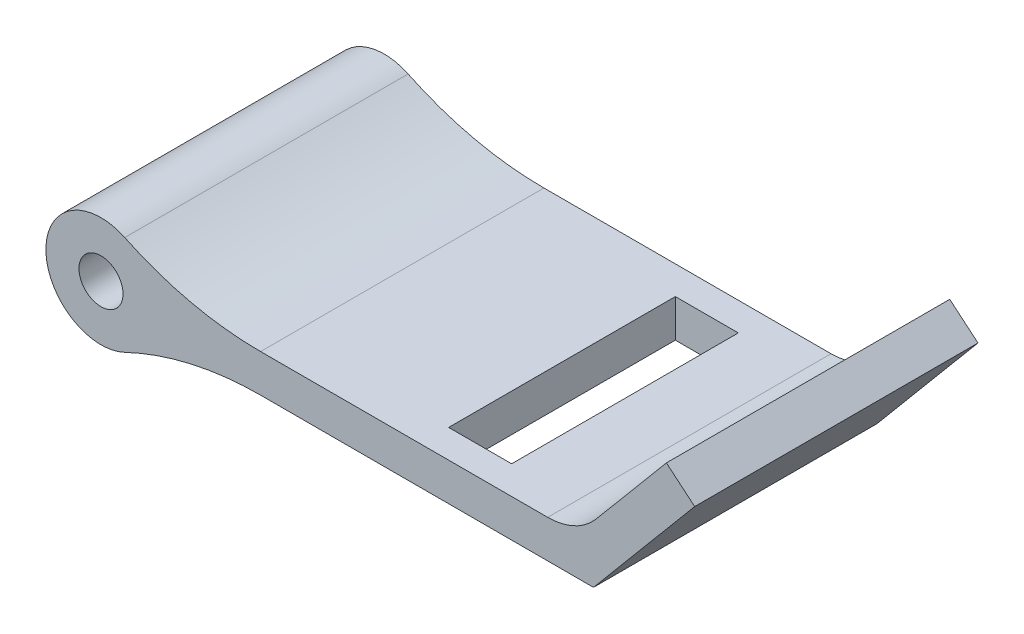
from build123d import *

# Parameters (mm, degrees)
SKETCH1_W                = 14
SKETCH1_H                = 9
SKETCH1_W_2              = 2
SKETCH1_H_2              = 7.2
BOSS_EXTRUDE1_DEPTH      = 1.2
BOSS_EXTRUDE2_DEPTH      = 4.5
BOSS_EXTRUDE2_DEPTH_BACK = 4.5
SKETCH2_R                = 1.75
SKETCH2_R_2              = 0.7
FILLET1_R                = 10
BOSS_EXTRUDE3_DEPTH      = 0.771345
BOSS_EXTRUDE3_DEPTH_BACK = 0.4
SKETCH3_W                = 9
SKETCH3_H                = 5
FILLET2_R                = 2


with BuildPart() as part:
    # Sketch1 → Boss-Extrude1 (new body)
    with BuildSketch(Plane(origin=(0, 0, 0), x_dir=(1, 0, 0), z_dir=(0, 1, 0))):
        Rectangle(SKETCH1_W, SKETCH1_H)
        with Locations((2.5, 0)):
            Rectangle(SKETCH1_W_2, SKETCH1_H_2, mode=Mode.SUBTRACT)
    extrude(amount=BOSS_EXTRUDE1_DEPTH)

    # Sketch2 → Boss-Extrude2 (add, two sides: drawn at the far end of the back side and taken through both)
    with BuildSketch(Plane.XY.offset(-BOSS_EXTRUDE2_DEPTH_BACK)):
        with Locations((-8.643928222, 0.6)):
            Circle(SKETCH2_R)
        with Locations((-8.643928222, 0.6)):
            Circle(SKETCH2_R_2, mode=Mode.SUBTRACT)
    extrude(amount=BOSS_EXTRUDE2_DEPTH + BOSS_EXTRUDE2_DEPTH_BACK)

    # Fillet1
    fillet1_edges = [part.edges().sort_by_distance(p)[0] for p in [
        (-7, 1.2, 0),
        (-7, 0, 0),
    ]]
    fillet(fillet1_edges, radius=FILLET1_R)

    # Sketch3 → Boss-Extrude3 (add, two sides: drawn at the far end of the back side and taken through both)
    with BuildSketch(Plane(origin=(3.51688397, -2.951016042, 0), x_dir=(0, 0, -1), z_dir=(0.7660444431189749, -0.642787609686543, 0)).offset(-BOSS_EXTRUDE3_DEPTH_BACK)):
        with Locations((0, 6.999513268)):
            Rectangle(SKETCH3_W, SKETCH3_H)
    extrude(amount=BOSS_EXTRUDE3_DEPTH + BOSS_EXTRUDE3_DEPTH_BACK)

    # Fillet2
    fillet2_edges = [part.edges().sort_by_distance(p)[0] for p in [
        (6.477837084, 1.2, 0),
    ]]
    fillet(fillet2_edges, radius=FILLET2_R)


solid = part.part
